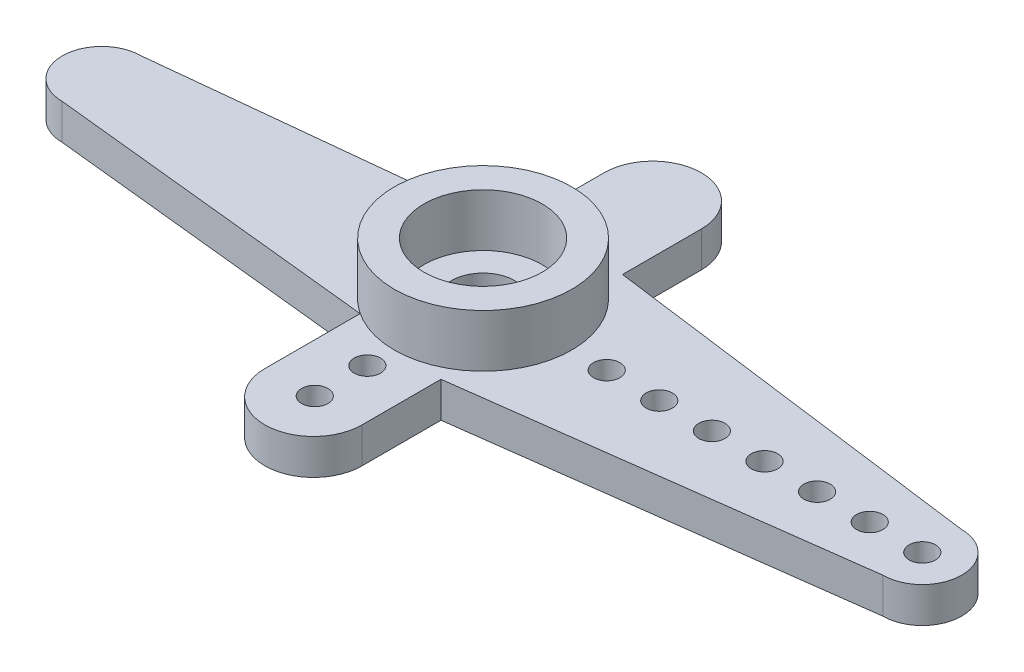
from build123d import *

# Parameters (mm, degrees)
SCHIZZO1_R                   = 3.375
ESTRUSIONE_ESTRUSIONE1_DEPTH = 1.35
SCHIZZO2_R                   = 3.375
ESTRUSIONE_ESTRUSIONE2_DEPTH = 2
SCHIZZO3_R                   = 2.25
TAGLIO_ESTRUSIONE1_DEPTH     = 2
SCHIZZO4_R                   = 1.2
TAGLIO_ESTRUSIONE2_DEPTH     = 21.102984853
SCHIZZO5_R                   = 0.5
TAGLIO_ESTRUSIONE3_DEPTH     = 21.281826841


with BuildPart() as part:
    # Schizzo1 → Estrusione-Estrusione1 (new body)
    with BuildSketch(Plane(origin=(0, 0, 0), x_dir=(1, 0, 0), z_dir=(0, 1, 0))):
        Circle(SCHIZZO1_R)
        with BuildLine():
            Line((-1.846618531, 2.825), (-14.5, 1.5))
            ThreePointArc((-14.5, 1.5), (-16, 0), (-14.5, -1.5))
            Line((-14.5, -1.5), (-1.846618531, -2.825))
            Line((-1.846618531, -2.825), (-1.846618531, 2.825))
        make_face()
        with BuildLine():
            Line((1.85, 3.45), (1.85, -3.45))
            Line((1.85, -3.45), (16.7, -1.5))
            ThreePointArc((16.7, -1.5), (18.2, 0), (16.7, 1.5))
            Line((16.7, 1.5), (1.85, 3.45))
        make_face()
        with BuildLine():
            Line((-1.85, -6.45), (-1.85, 6.45))
            ThreePointArc((-1.85, 6.45), (0, 8.3), (1.85, 6.45))
            Line((1.85, 6.45), (1.85, -6.45))
            ThreePointArc((1.85, -6.45), (0, -8.3), (-1.85, -6.45))
        make_face()
    extrude(amount=ESTRUSIONE_ESTRUSIONE1_DEPTH)

    # Schizzo2 → Estrusione-Estrusione2 (add)
    with BuildSketch(Plane(origin=(0, 1.35, 0), x_dir=(1, 0, 0), z_dir=(0, 1, 0))):
        with Locations(Location((0, 0, 0), (0, 0, 270))):
            Circle(SCHIZZO2_R)
    extrude(amount=ESTRUSIONE_ESTRUSIONE2_DEPTH)

    # Schizzo3 → Taglio-Estrusione1 (cut)
    with BuildSketch(Plane(origin=(0, 3.35, 0), x_dir=(1, 0, 0), z_dir=(0, 1, 0))):
        with Locations(Location((0, 0, 0), (0, 0, 270))):
            Circle(SCHIZZO3_R)
    extrude(amount=-TAGLIO_ESTRUSIONE1_DEPTH, mode=Mode.SUBTRACT)

    # Schizzo4 → Taglio-Estrusione2 (cut, through all)
    with BuildSketch(Plane(origin=(0, 1.35, 0), x_dir=(1, 0, 0), z_dir=(0, 1, 0))):
        with Locations(Location((0, 0, 0), (0, 0, 270))):
            Circle(SCHIZZO4_R)
    extrude(amount=-TAGLIO_ESTRUSIONE2_DEPTH, mode=Mode.SUBTRACT)

    # Schizzo5 → Taglio-Estrusione3 (cut, through all)
    with BuildSketch(Plane.XZ):
        with Locations(Location((8.7, 0, 0), (0, 0, 270))):
            Circle(SCHIZZO5_R)
        with Locations(Location((10.7, 0, 0), (0, 0, 270))):
            Circle(SCHIZZO5_R)
        with Locations(Location((12.7, 0, 0), (0, 0, 270))):
            Circle(SCHIZZO5_R)
        with Locations(Location((14.7, 0, 0), (0, 0, 270))):
            Circle(SCHIZZO5_R)
        with Locations(Location((16.7, 0, 0), (0, 0, 270))):
            Circle(SCHIZZO5_R)
        with Locations(Location((6.7, 0, 0), (0, 0, 270))):
            Circle(SCHIZZO5_R)
        with Locations(Location((4.7, 0, 0), (0, 0, 270))):
            Circle(SCHIZZO5_R)
        with Locations(Location((0, 4.4, 0), (0, 0, 270))):
            Circle(SCHIZZO5_R)
        with Locations(Location((0, 6.4, 0), (0, 0, 270))):
            Circle(SCHIZZO5_R)
    extrude(amount=-TAGLIO_ESTRUSIONE3_DEPTH, mode=Mode.SUBTRACT)


solid = part.part
